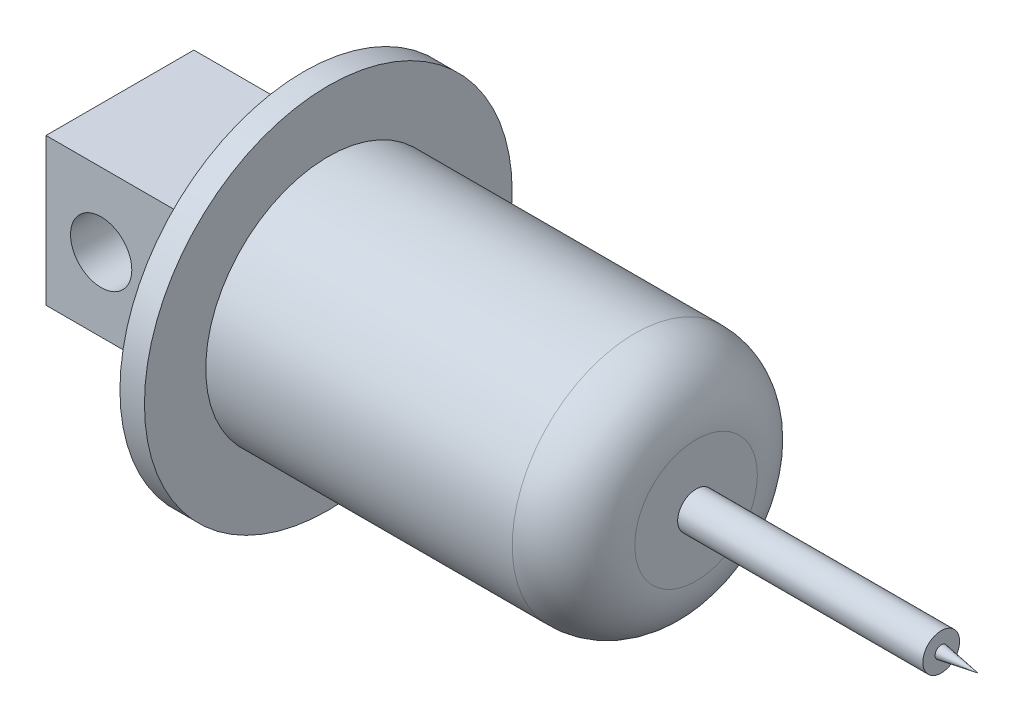
from build123d import *

# Parameters (mm, degrees)
SKETCH1_R             = 10
BOSS_EXTRUDE1_DEPTH   = 30
SKETCH4_R             = 15
BOSS_EXTRUDE2_DEPTH   = 2
FILLET1_R             = 5
SKETCH6_R             = 1.5
BOSS_EXTRUDE3_DEPTH   = 20
SKETCH7_W             = 12.06257879
SKETCH7_H             = 12
BOSS_EXTRUDE4_DEPTH   = 15
SKETCH8_R             = 2.5
CUT_EXTRUDE2_DEPTH    = 57.278904872
BODY_MOVE_COPY5_ANGLE = 90


with BuildPart() as part:
    # Sketch1 → Boss-Extrude1 (new body)
    with BuildSketch(Plane.XY):
        Circle(SKETCH1_R)
    extrude(amount=BOSS_EXTRUDE1_DEPTH)

    # Sketch4 → Boss-Extrude2 (add)
    with BuildSketch(Plane(origin=(0, 0, 0), x_dir=(-1, 0, 0), z_dir=(0, 0, -1))):
        Circle(SKETCH4_R)
    extrude(amount=BOSS_EXTRUDE2_DEPTH)

    # Fillet1
    fillet1_edges = [part.edges().sort_by_distance(p)[0] for p in [
        (-10, 0, 30),
    ]]
    fillet(fillet1_edges, radius=FILLET1_R)

    # Sketch6 → Boss-Extrude3 (add)
    with BuildSketch(Plane.XY.offset(30)):
        Circle(SKETCH6_R)
    extrude(amount=BOSS_EXTRUDE3_DEPTH)

    # Sketch7 → Boss-Extrude4 (add)
    with BuildSketch(Plane(origin=(0, 0, -2), x_dir=(-1, 0, 0), z_dir=(0, 0, -1))):
        Rectangle(SKETCH7_W, SKETCH7_H)
    extrude(amount=BOSS_EXTRUDE4_DEPTH)

    # Sketch8 → Cut-Extrude2 (cut, through all)
    with BuildSketch(Plane.ZY.offset(6.031289395)):
        with Locations((-12.5, 0)):
            Circle(SKETCH8_R)
    extrude(amount=-CUT_EXTRUDE2_DEPTH, mode=Mode.SUBTRACT)

    # Sketch15 → Revolve2 (revolve)
    with BuildSketch(Plane(origin=(0, 0, 0), x_dir=(1, 0, 0), z_dir=(0, 1, 0)), mode=Mode.PRIVATE) as revolve2_sk:
        Polygon((0.5, -50), (0, -53), (0, -50), align=None)
    revolve(revolve2_sk.sketch.rotate(Axis((0, 0, 50), (0, 0, 1)), 180), axis=Axis((0, 0, 50), (0, 0, 1)))


with BuildPart() as part_1:
    # Body-Move/Copy3: moved
    add(part.part.moved(Location((0, 0, -50))))


with BuildPart() as part_2:
    # Body-Move/Copy5: moved
    add(part_1.part.rotate(Axis((0, 0, 0), (0, 1, 0)), BODY_MOVE_COPY5_ANGLE))


solid = part_2.part
